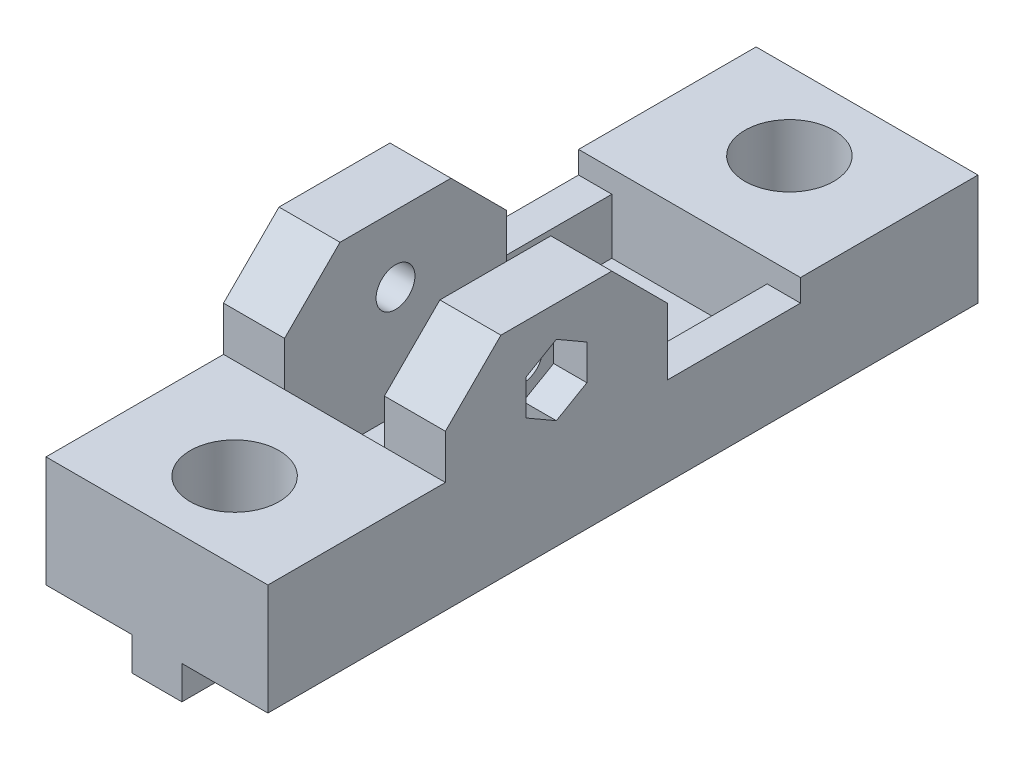
from build123d import *

# Parameters (mm, degrees)
SKETCH1_W               = 20
SKETCH1_H               = 30
BOSS_EXTRUDE1_DEPTH     = 3
SKETCH2_W               = 4.5
SKETCH2_H               = 12
BOSS_EXTRUDE2_DEPTH     = 3
SKETCH3_R               = 7
SKETCH3_R_2             = 4
BOSS_EXTRUDE3_DEPTH     = 7
SKETCH4_R               = 4
BOSS_EXTRUDE4_DEPTH     = 1
CUT_EXTRUDE1_DEPTH      = 20.339079606
CUT_EXTRUDE1_DEPTH_BACK = 20.339079606
SKETCH5_R               = 3
SKETCH6_R               = 7
SKETCH6_R_2             = 4
BOSS_EXTRUDE6_DEPTH     = 7
SKETCH7_W               = 20
SKETCH7_H               = 3
BOSS_EXTRUDE7_DEPTH     = 19
SKETCH8_W               = 4.5
SKETCH8_H               = 3
BOSS_EXTRUDE8_DEPTH     = 12
SKETCH10_W              = 5.5
SKETCH10_H              = 20
BOSS_EXTRUDE9_DEPTH     = 16
CUT_EXTRUDE2_DEPTH      = 57.231663678
CUT_EXTRUDE2_DEPTH_BACK = 57.231663678
SKETCH11_R              = 1.75
SKETCH12_R              = 3
SKETCH12_R_2            = 1.75
CUT_EXTRUDE3_DEPTH      = 3
CUT_EXTRUDE4_START      = -3
SKETCH13_R              = 1.75
CUT_EXTRUDE4_DEPTH      = 3
CHAMFER2_SIZE           = 5
CUT_EXTRUDE5_START      = -1.5
SKETCH14_R              = 4
CUT_EXTRUDE5_DEPTH      = 1.5
SKETCH15_W              = 3
SKETCH15_H              = 12
BOSS_EXTRUDE10_DEPTH    = 5


with BuildPart() as part:
    # Sketch1 → Boss-Extrude1 (new body)
    with BuildSketch(Plane(origin=(0, 0, 0), x_dir=(1, 0, 0), z_dir=(0, 1, 0))):
        Rectangle(SKETCH1_W, SKETCH1_H)
    boss_extrude1 = extrude(amount=BOSS_EXTRUDE1_DEPTH)

    # Sketch2 → Boss-Extrude2 (add)
    with BuildSketch(Plane.XZ):
        with Locations((0, -9)):
            Rectangle(SKETCH2_W, SKETCH2_H)
    boss_extrude2 = extrude(amount=BOSS_EXTRUDE2_DEPTH)

    # Sketch3 → Boss-Extrude3 (add)
    with BuildSketch(Plane(origin=(0, 3, 0), x_dir=(1, 0, 0), z_dir=(0, 1, 0))):
        with Locations(Location((0, 8, 0), (0, 0, 90))):
            Circle(SKETCH3_R)
        with Locations(Location((0, 8, 0), (0, 0, 270))):
            Circle(SKETCH3_R_2, mode=Mode.SUBTRACT)
    boss_extrude3 = extrude(amount=BOSS_EXTRUDE3_DEPTH)

    # Sketch4 → Boss-Extrude4 (add)
    with BuildSketch(Plane(origin=(0, 3, 0), x_dir=(1, 0, 0), z_dir=(0, 1, 0))):
        with Locations(Location((0, 8, 0), (0, 0, 270))):
            Circle(SKETCH4_R)
    boss_extrude4 = extrude(amount=BOSS_EXTRUDE4_DEPTH)

    # Sketch5 → Cut-Extrude1 (cut, two sides: drawn at the far end of the back side and taken through both)
    with BuildSketch(Plane(origin=(0, 3, 0), x_dir=(1, 0, 0), z_dir=(0, 1, 0)).offset(-CUT_EXTRUDE1_DEPTH_BACK)):
        with Locations(Location((0, -8.5, 0), (0, 0, 90))):
            Circle(SKETCH5_R)
    extrude(amount=CUT_EXTRUDE1_DEPTH + CUT_EXTRUDE1_DEPTH_BACK, mode=Mode.SUBTRACT)

    # Sketch6 → Boss-Extrude6 (add)
    # profile 1 of 2: a face of its own
    with BuildSketch(Plane(origin=(0, 3, 0), x_dir=(1, 0, 0), z_dir=(0, 1, 0))):
        Polygon((0, 15), (-10, 15), (-10, -1), (10, -1), (10, 15), align=None)
        with BuildLine():
            ThreePointArc((7, 8), (-4.949747468, 3.050252532), (0, 15))
            ThreePointArc((0, 15), (4.949747468, 12.949747468), (7, 8))
        make_face(mode=Mode.SUBTRACT)
    # profile 2 of 2: a face of its own
    with BuildSketch(Plane(origin=(0, 3, 0), x_dir=(1, 0, 0), z_dir=(0, 1, 0))):
        with Locations((0, 8)):
            Circle(SKETCH6_R)
        with Locations(Location((0, 8, 0), (0, 0, 270))):
            Circle(SKETCH6_R_2, mode=Mode.SUBTRACT)
    boss_extrude6 = extrude(amount=BOSS_EXTRUDE6_DEPTH)

    # Sketch7 → Boss-Extrude7 (add)
    with BuildSketch(Plane.XY.offset(15)):
        with Locations((0, 1.5)):
            Rectangle(SKETCH7_W, SKETCH7_H)
    extrude(amount=BOSS_EXTRUDE7_DEPTH)

    # Mirror3: Boss-Extrude1, Boss-Extrude2, Boss-Extrude3, Boss-Extrude4, Boss-Extrude6 across plane
    add(boss_extrude1.mirror(Plane.XY.offset(17)))
    add(boss_extrude2.mirror(Plane.XY.offset(17)))
    add(boss_extrude3.mirror(Plane.XY.offset(17)))
    add(boss_extrude4.mirror(Plane.XY.offset(17)))
    add(boss_extrude6.mirror(Plane.XY.offset(17)))

    # Sketch8 → Boss-Extrude8 (add)
    with BuildSketch(Plane(origin=(0, 0, 37), x_dir=(-1, 0, 0), z_dir=(0, 0, -1))):
        with Locations((0, -1.5)):
            Rectangle(SKETCH8_W, SKETCH8_H)
    extrude(amount=BOSS_EXTRUDE8_DEPTH)

    # Sketch10 → Boss-Extrude9 (add)
    with BuildSketch(Plane(origin=(0, 3, 0), x_dir=(1, 0, 0), z_dir=(0, 1, 0))):
        with Locations((-7.25, -23)):
            Rectangle(SKETCH10_W, SKETCH10_H)
        with Locations((7.25, -23)):
            Rectangle(SKETCH10_W, SKETCH10_H)
    extrude(amount=BOSS_EXTRUDE9_DEPTH)

    # Sketch11 → Cut-Extrude2 (cut, two sides: drawn at the far end of the back side and taken through both)
    with BuildSketch(Plane.ZY.offset(10).offset(-CUT_EXTRUDE2_DEPTH_BACK)):
        with Locations((23, 13)):
            Circle(SKETCH11_R)
    extrude(amount=CUT_EXTRUDE2_DEPTH + CUT_EXTRUDE2_DEPTH_BACK, mode=Mode.SUBTRACT)

    # Sketch12 → Cut-Extrude3 (cut)
    with BuildSketch(Plane.ZY.offset(10)):
        with Locations((23, 13)):
            Circle(SKETCH12_R)
        with Locations((23, 13)):
            Circle(SKETCH12_R_2, mode=Mode.SUBTRACT)
    extrude(amount=-CUT_EXTRUDE3_DEPTH, mode=Mode.SUBTRACT)

    # Sketch13 → Cut-Extrude4 (cut)
    with BuildSketch(Plane(origin=(10, 0, 0), x_dir=(0, 0, -1), z_dir=(1, 0, 0)).offset(CUT_EXTRUDE4_START)):
        Polygon((-23, 16.175426481), (-25.75, 14.58771324), (-25.75, 11.41228676), (-23, 9.824573519), (-20.25, 11.41228676), (-20.25, 14.58771324), align=None)
        with Locations((-23, 13)):
            Circle(SKETCH13_R, mode=Mode.SUBTRACT)
    extrude(amount=CUT_EXTRUDE4_DEPTH, mode=Mode.SUBTRACT)

    # Chamfer2
    chamfer2_edges = [part.edges().sort_by_distance(p)[0] for p in [
        (-7.25, 19, 13),
        (-7.25, 19, 33),
        (7.25, 19, 13),
        (7.25, 19, 33),
    ]]
    chamfer(chamfer2_edges, length=CHAMFER2_SIZE)

    # Sketch14 → Cut-Extrude5 (cut)
    with BuildSketch(Plane(origin=(0, 4, 0), x_dir=(1, 0, 0), z_dir=(0, 1, 0)).offset(CUT_EXTRUDE5_START)):
        with Locations(Location((0, -42, 0), (0, 0, 90))):
            Circle(SKETCH14_R)
        with Locations(Location((0, 8, 0), (0, 0, 270))):
            Circle(SKETCH14_R)
    extrude(amount=CUT_EXTRUDE5_DEPTH, mode=Mode.SUBTRACT)

    # Sketch15 → Boss-Extrude10 (add)
    with BuildSketch(Plane(origin=(0, 3, 0), x_dir=(1, 0, 0), z_dir=(0, 1, 0))):
        with Locations((-8.5, -7)):
            Rectangle(SKETCH15_W, SKETCH15_H)
        with Locations((8.5, -7)):
            Rectangle(SKETCH15_W, SKETCH15_H)
    extrude(amount=BOSS_EXTRUDE10_DEPTH)


solid = part.part
